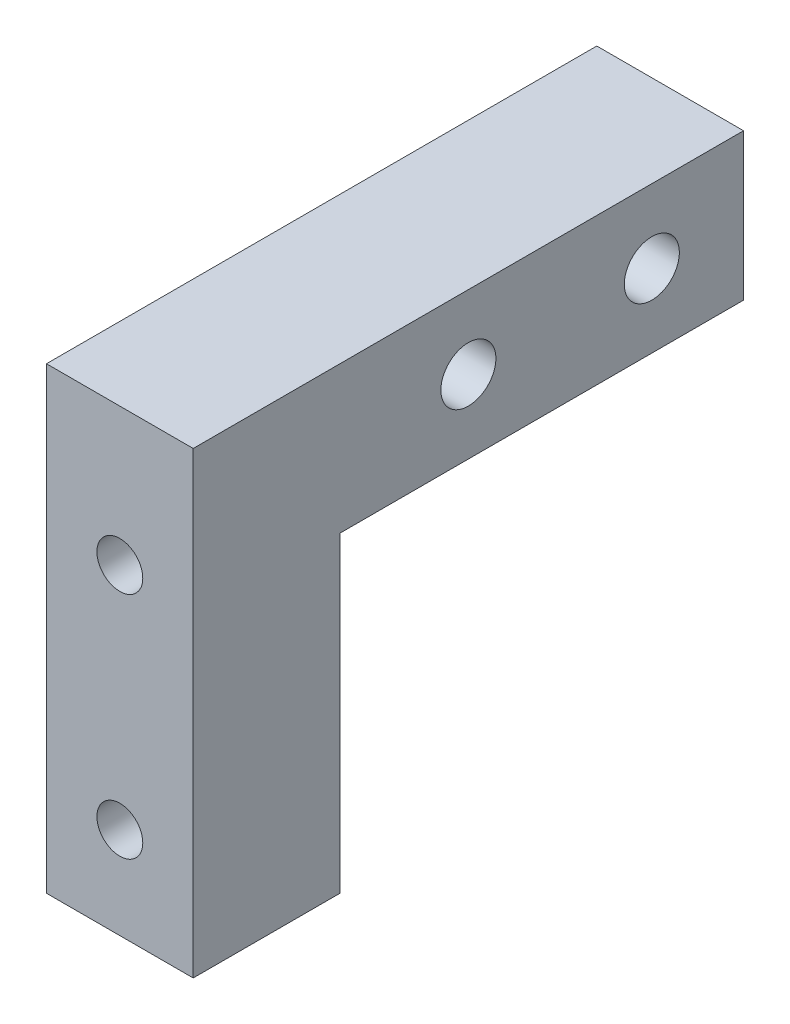
from build123d import *

# Parameters (mm, degrees)
BOSS_EXTRUDE1_DEPTH          = 8
SKETCH2_R                    = 3
CUT_EXTRUDE1_DEPTH           = 58.861904566
F_5_0_5_DIAMETER_HOLE2_D     = 5
F_5_0_5_DIAMETER_HOLE2_DEPTH = 12
F_5_0_5_DIAMETER_HOLE2_TIP   = 1.502151548


with BuildPart() as part:
    # Sketch1 → Boss-Extrude1 (new, symmetric)
    with BuildSketch(Plane(origin=(0, 0, 0), x_dir=(0, 0, -1), z_dir=(1, 0, 0))):
        Polygon((0, 0), (0, -34), (-16, -34), (-16, 16), (44, 16), (44, 0), align=None)
    extrude(amount=BOSS_EXTRUDE1_DEPTH, both=True)

    # Sketch2 → Cut-Extrude1 (cut, through all)
    with BuildSketch(Plane.ZY.offset(8)):
        with Locations((-34, 8)):
            Circle(SKETCH2_R)
        with Locations((-14, 8)):
            Circle(SKETCH2_R)
    extrude(amount=-CUT_EXTRUDE1_DEPTH, mode=Mode.SUBTRACT)

    # Ø5.0 (5) Diameter Hole2
    with Locations(Plane(origin=(0, 1, 16), x_dir=(1, 0, 0), z_dir=(0, 0, 1))):
        with Locations((0, 0), (0, -25)):
            Hole(F_5_0_5_DIAMETER_HOLE2_D / 2, depth=F_5_0_5_DIAMETER_HOLE2_DEPTH)
            with Locations((0, 0, -(F_5_0_5_DIAMETER_HOLE2_DEPTH + F_5_0_5_DIAMETER_HOLE2_TIP / 2))):  # 118° drill point
                Cone(0, F_5_0_5_DIAMETER_HOLE2_D / 2, F_5_0_5_DIAMETER_HOLE2_TIP, mode=Mode.SUBTRACT)


solid = part.part
